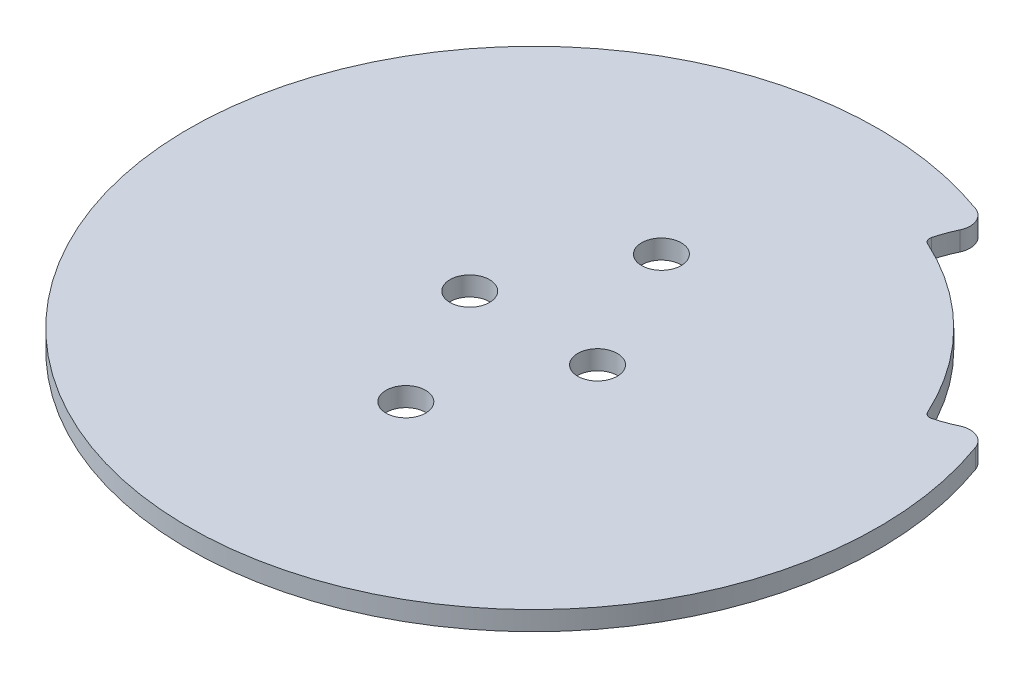
from build123d import *

# Parameters (mm, degrees)
SKETCH1_R           = 3.1
BOSS_EXTRUDE1_DEPTH = 3
FILLET1_R           = 3
FILLET2_R           = 1


with BuildPart() as part:
    # Sketch1 → Boss-Extrude1 (new body)
    with BuildSketch(Plane(origin=(0, 0, 0), x_dir=(1, 0, 0), z_dir=(0, 1, 0))):
        with BuildLine():
            ThreePointArc((21.667324002, 49.462380357), (-38.183766184, -38.183766184), (49.462380357, 21.667324002))
            ThreePointArc((49.462380357, 21.667324002), (46.165505457, 19.845504593), (42.585510083, 18.674162122))
            ThreePointArc((42.585510083, 18.674162122), (32.880465325, 32.880465325), (18.674162122, 42.585510083))
            ThreePointArc((18.674162122, 42.585510083), (19.845504593, 46.165505457), (21.667324002, 49.462380357))
        make_face()
        with Locations(Location((10, 0, 0), (0, 0, 270))):
            Circle(SKETCH1_R, mode=Mode.SUBTRACT)
        with Locations(Location((0, 20, 0), (0, 0, 270))):
            Circle(SKETCH1_R, mode=Mode.SUBTRACT)
        with Locations(Location((0, -20, 0), (0, 0, 270))):
            Circle(SKETCH1_R, mode=Mode.SUBTRACT)
        with Locations(Location((-10, 0, 0), (0, 0, 270))):
            Circle(SKETCH1_R, mode=Mode.SUBTRACT)
    extrude(amount=BOSS_EXTRUDE1_DEPTH)

    # Fillet1
    fillet1_edges = [part.edges().sort_by_distance(p)[0] for p in [
        (49.462380357, 1.5, -21.667324002),
        (21.667324002, 1.5, -49.462380357),
    ]]
    fillet(fillet1_edges, radius=FILLET1_R)

    # Fillet2
    fillet2_edges = [part.edges().sort_by_distance(p)[0] for p in [
        (18.674162122, 1.5, -42.585510083),
        (42.585510083, 1.5, -18.674162122),
    ]]
    fillet(fillet2_edges, radius=FILLET2_R)


solid = part.part
